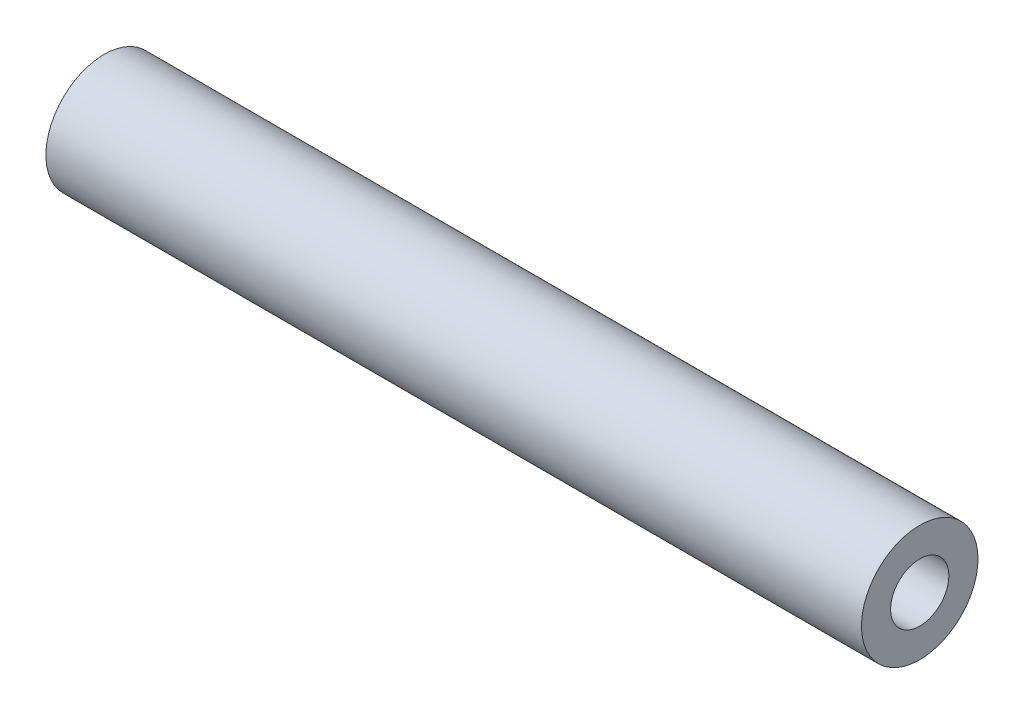
from build123d import *

# Parameters (mm, degrees)
SKETCH1_R           = 12.7
SKETCH1_R_2         = 6.35
BOSS_EXTRUDE1_DEPTH = 177.8


with BuildPart() as part:
    # Sketch1 → Boss-Extrude1 (new body)
    with BuildSketch(Plane(origin=(0, 0, 0), x_dir=(0, 0, -1), z_dir=(1, 0, 0))):
        Circle(SKETCH1_R)
        Circle(SKETCH1_R_2, mode=Mode.SUBTRACT)
    extrude(amount=BOSS_EXTRUDE1_DEPTH)


solid = part.part
